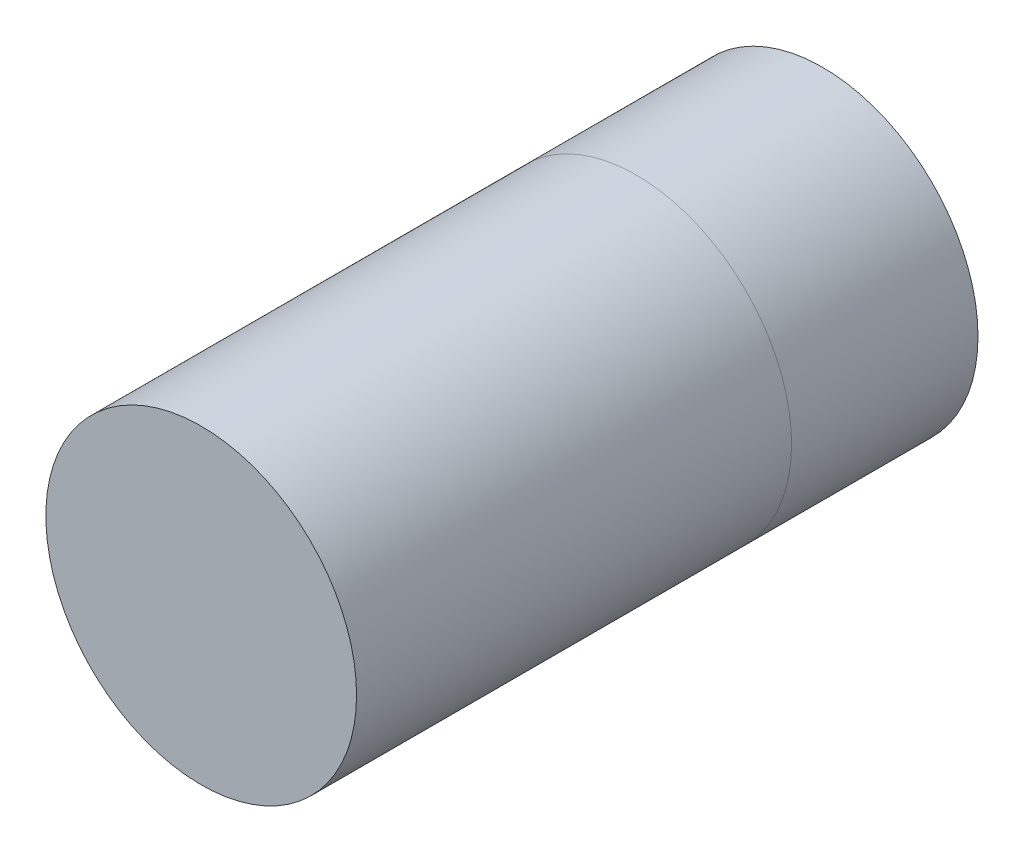
from build123d import *

# Parameters (mm, degrees)
ESBO_O1_R                = 2.5
RESSALTO_EXTRUS_O1_DEPTH = 3
ESBO_O2_R                = 2.5
RESSALTO_EXTRUS_O2_DEPTH = 7


with BuildPart() as part:
    # Esboço1 → Ressalto-extrusão1 (new body)
    with BuildSketch(Plane.XY):
        Circle(ESBO_O1_R)
    extrude(amount=RESSALTO_EXTRUS_O1_DEPTH)


with BuildPart() as body_2:
    # Esboço2 → Ressalto-extrusão2 (new body)
    with BuildSketch(Plane.XY.offset(3)):
        Circle(ESBO_O2_R)
    extrude(amount=RESSALTO_EXTRUS_O2_DEPTH)


solid = Compound([part.part, body_2.part])
